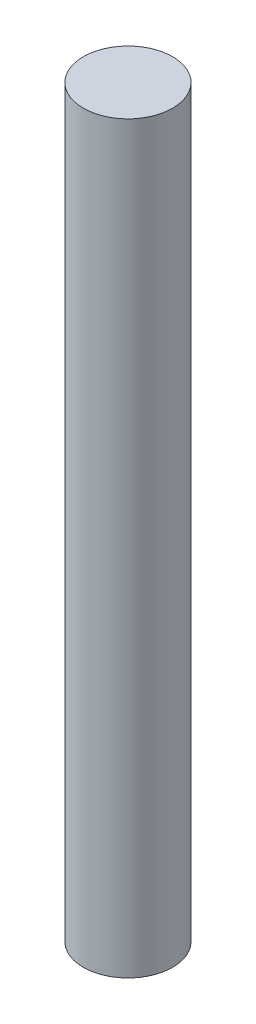
from build123d import *

# Parameters (mm, degrees)
SKETCH1_R           = 1.5
BOSS_EXTRUDE1_DEPTH = 25


with BuildPart() as part:
    # Sketch1 → Boss-Extrude1 (new body)
    with BuildSketch(Plane(origin=(0, 0, 0), x_dir=(1, 0, 0), z_dir=(0, 1, 0))):
        with Locations(Location((0, 0, 0), (0, 0, 270))):
            Circle(SKETCH1_R)
    extrude(amount=BOSS_EXTRUDE1_DEPTH)


solid = part.part
